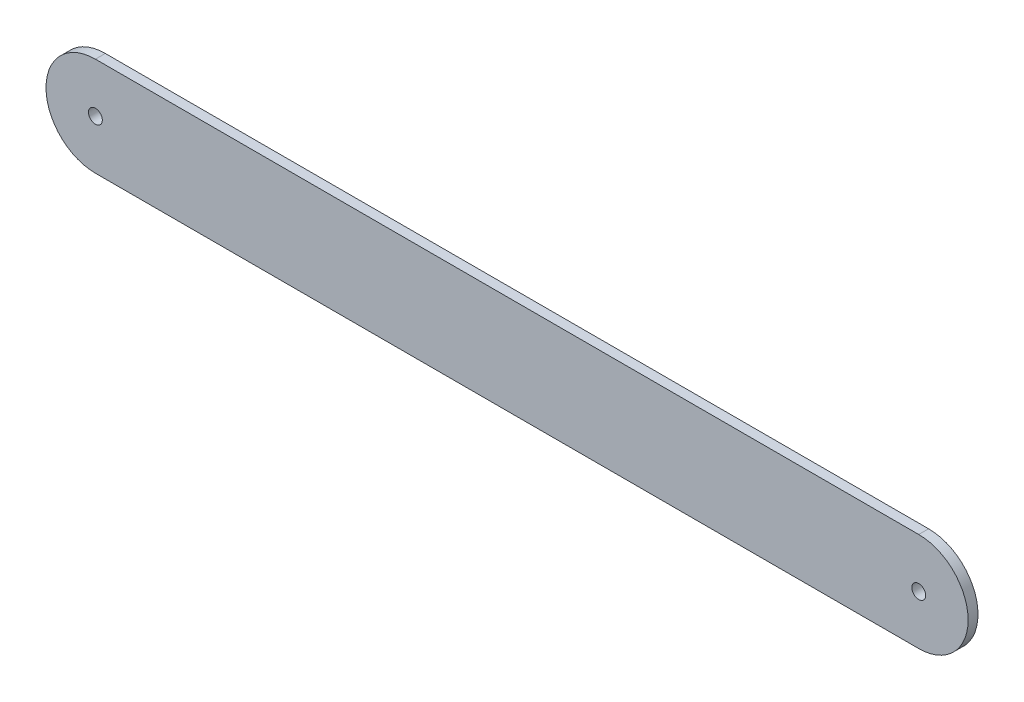
from build123d import *

# Parameters (mm, degrees)
ESQUISSE1_R        = 2.1
BOSS_EXTRU_1_DEPTH = 3


with BuildPart() as part:
    # Esquisse1 → Boss.-Extru.1 (new body)
    with BuildSketch(Plane.XY):
        with BuildLine():
            Line((0, 15), (125, 15))
            ThreePointArc((125, 15), (140, 0), (125, -15))
            Line((125, -15), (0, -15))
            Line((0, -15), (0, 15))
        make_face()
        with Locations((125, 0)):
            Circle(ESQUISSE1_R, mode=Mode.SUBTRACT)
    extrude(amount=BOSS_EXTRU_1_DEPTH)

    # Symétrie1: part across plane


with BuildPart() as part_1:
    add(part.part)
    add(part.part.mirror(Plane(origin=(0, 15, 3), x_dir=(0, 0, 1), z_dir=(1, 0, 0))))


solid = part_1.part
